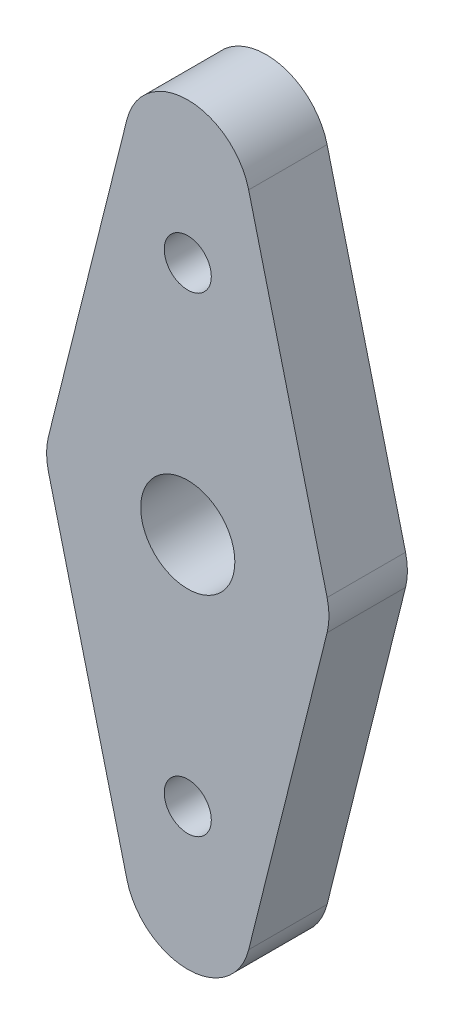
from build123d import *

# Parameters (mm, degrees)
EXTRUDE_1_DEPTH     = 5
SKETCH_2_R          = 3
CUT_EXTRUDE_2_DEPTH = 27.115129714
SKETCH_3_R          = 1.5
CUT_EXTRUDE_3_DEPTH = 100


with BuildPart() as part:
    # 草圖1 → 伸長1 (new body)
    with BuildSketch(Plane.XY):
        with BuildLine():
            Line((-3.880570001, 20.9701425), (-8.880570001, 0.9701425))
            ThreePointArc((-8.880570001, 0.9701425), (-9, 0), (-8.880570001, -0.9701425))
            Line((-8.880570001, -0.9701425), (-3.880570001, -20.9701425))
            ThreePointArc((-3.880570001, -20.9701425), (0, -24), (3.880570001, -20.9701425))
            Line((3.880570001, -20.9701425), (8.880570001, -0.9701425))
            ThreePointArc((8.880570001, -0.9701425), (9, 0), (8.880570001, 0.9701425))
            Line((8.880570001, 0.9701425), (3.880570001, 20.9701425))
            ThreePointArc((3.880570001, 20.9701425), (0, 24), (-3.880570001, 20.9701425))
        make_face()
    extrude(amount=EXTRUDE_1_DEPTH)

    # 草圖2 → 伸長2 (cut, through all)
    with BuildSketch(Plane.XY.offset(5)):
        Circle(SKETCH_2_R)
    extrude(amount=-CUT_EXTRUDE_2_DEPTH, mode=Mode.SUBTRACT)

    # 草圖3 → 伸長3 (cut)
    with BuildSketch(Plane.XY.offset(5)):
        with Locations((0, 15)):
            Circle(SKETCH_3_R)
        with Locations((0, -15)):
            Circle(SKETCH_3_R)
    extrude(amount=-CUT_EXTRUDE_3_DEPTH, mode=Mode.SUBTRACT)


solid = part.part
